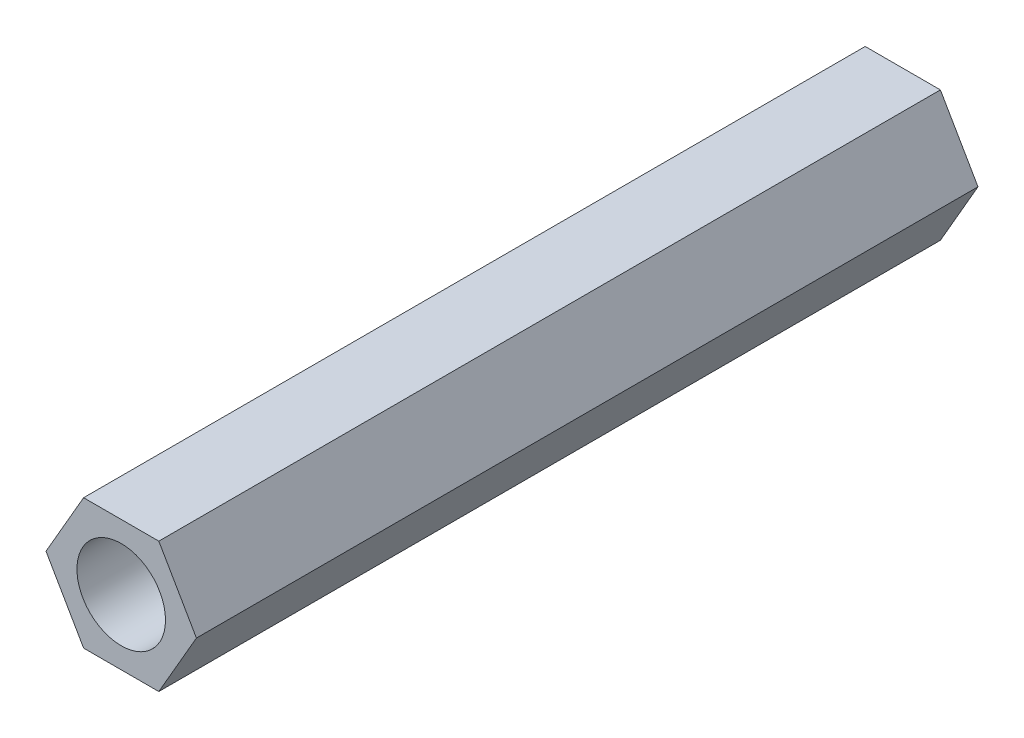
from build123d import *

# Parameters (mm, degrees)
EXTRUDE_1_DEPTH              = 30
HOLE_WIZARD_M3_2_D           = 3.4
HOLE_WIZARD_M3_2_ON_FACE_2_D = 3.4


with BuildPart() as part:
    # 스케치1 → 보스-돌출1 (new body)
    with BuildSketch(Plane.XY):
        Polygon((1.443375673, -2.5), (2.886751346, 0), (1.443375673, 2.5), (-1.443375673, 2.5), (-2.886751346, 0), (-1.443375673, -2.5), align=None)
    extrude(amount=EXTRUDE_1_DEPTH)

    # M3 여유 구멍2 (through all)
    with Locations(Plane(origin=(0, 0, 0), x_dir=(-1, 0, 0), z_dir=(0, 0, -1))):
        with Locations((0, 0)):
            Hole(HOLE_WIZARD_M3_2_D / 2)

    # M3 여유 구멍2 on face 2 (through all)
    with Locations(Plane.XY.offset(30)):
        with Locations((0, 0)):
            Hole(HOLE_WIZARD_M3_2_ON_FACE_2_D / 2)


solid = part.part
